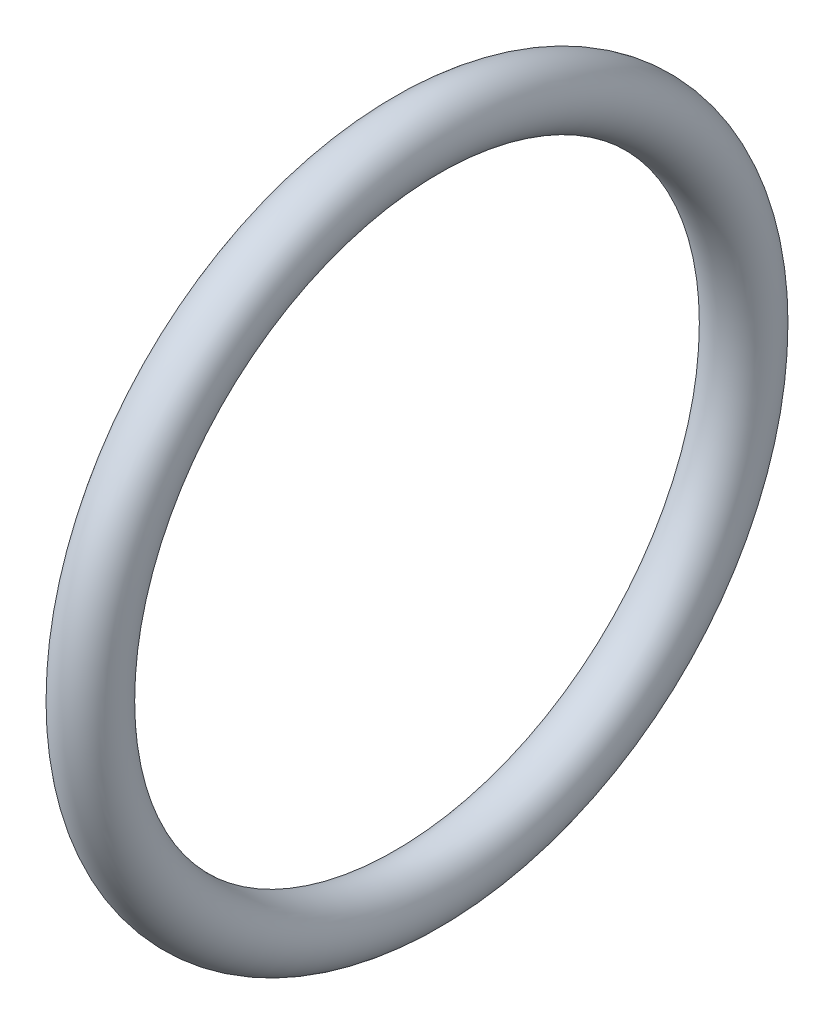
from build123d import *

# Parameters (mm, degrees)
SKETCH1_R = 2.5


with BuildPart() as part:
    # Sketch1 → Revolve1 (revolve)
    with BuildSketch(Plane.XY, mode=Mode.PRIVATE) as revolve1_sk:
        with Locations((7.516660498, 26.041451884)):
            Circle(SKETCH1_R)
    revolve(revolve1_sk.sketch.rotate(Axis((-8.977593231, 0, 0), (1, 0, 0)), 90), axis=Axis((-8.977593231, 0, 0), (1, 0, 0)))


solid = part.part
